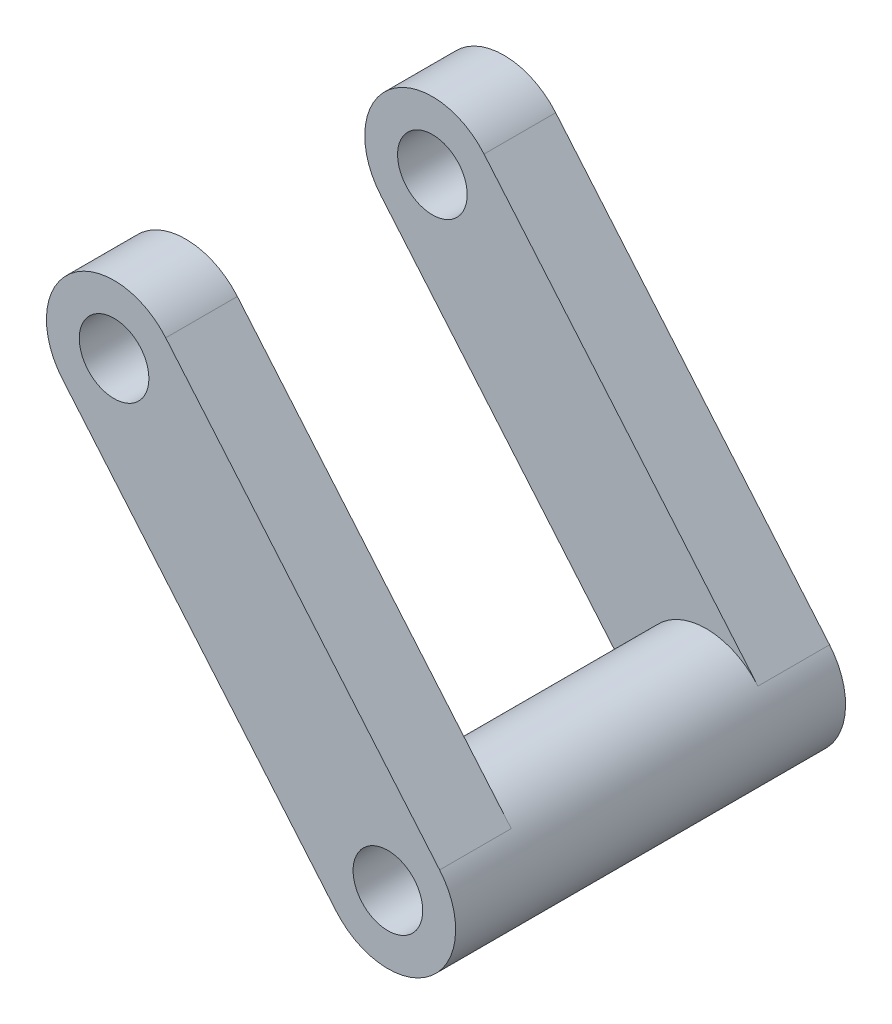
from build123d import *
from build123d.topology import SkipClean

# Parameters (mm, degrees)
SALIENTE_EXTRUIR1_START = 0.2
CROQUIS1_R              = 1.75
SALIENTE_EXTRUIR1_DEPTH = 3.6
CROQUIS2_R              = 3.40408827
CROQUIS2_R_2            = 1.75
SALIENTE_EXTRUIR2_DEPTH = 6.2


with BuildPart() as part:
    # Croquis1 → Saliente-Extruir1 (new body)
    with BuildSketch(Plane.XY.offset(SALIENTE_EXTRUIR1_START)):
        with BuildLine():
            Line((-80.917805582, 11.650275301), (-67.150813208, -4.628100839))
            ThreePointArc((-67.150813208, -4.628100839), (-67.552307173, -9.425900411), (-72.350029665, -9.023486412))
            Line((-72.350029665, -9.023486412), (-86.110777841, 7.260168535))
            ThreePointArc((-86.110777841, 7.260168535), (-85.708924205, 12.051210184), (-80.917805582, 11.650275301))
        make_face()
        with Locations((-69.75, -6.826292135)):
            Circle(CROQUIS1_R, mode=Mode.SUBTRACT)
        with Locations((-83.513870781, 9.454724007)):
            Circle(CROQUIS1_R, mode=Mode.SUBTRACT)
    saliente_extruir1 = extrude(amount=SALIENTE_EXTRUIR1_DEPTH)

    # Croquis2 → Saliente-Extruir2 (add)
    with SkipClean():  # the faces are left unmerged after this step: merging them gives an invalid solid
        with BuildSketch(Plane.XY.offset(3.8)):
            with Locations(Location((-69.75, -6.826292135, 0), (0, 0, 220.199985321))):
                Circle(CROQUIS2_R)
            with Locations(Location((-69.75, -6.826292135, 0), (0, 0, 90))):
                Circle(CROQUIS2_R_2, mode=Mode.SUBTRACT)
        saliente_extruir2 = extrude(amount=SALIENTE_EXTRUIR2_DEPTH)

    # Simetría1: Saliente-Extruir2 across plane
    with SkipClean():  # the faces are left unmerged after this step: merging them gives an invalid solid
        add(saliente_extruir2.mirror(Plane(origin=(0, 0, 10), x_dir=(1, 0, 0), z_dir=(0, 0, -1))))

    # Simetría4: Saliente-Extruir1 across plane
    with SkipClean():  # the faces are left unmerged after this step: merging them gives an invalid solid
        add(saliente_extruir1.mirror(Plane(origin=(0, 0, 10), x_dir=(1, 0, 0), z_dir=(0, 0, -1))))


solid = part.part
